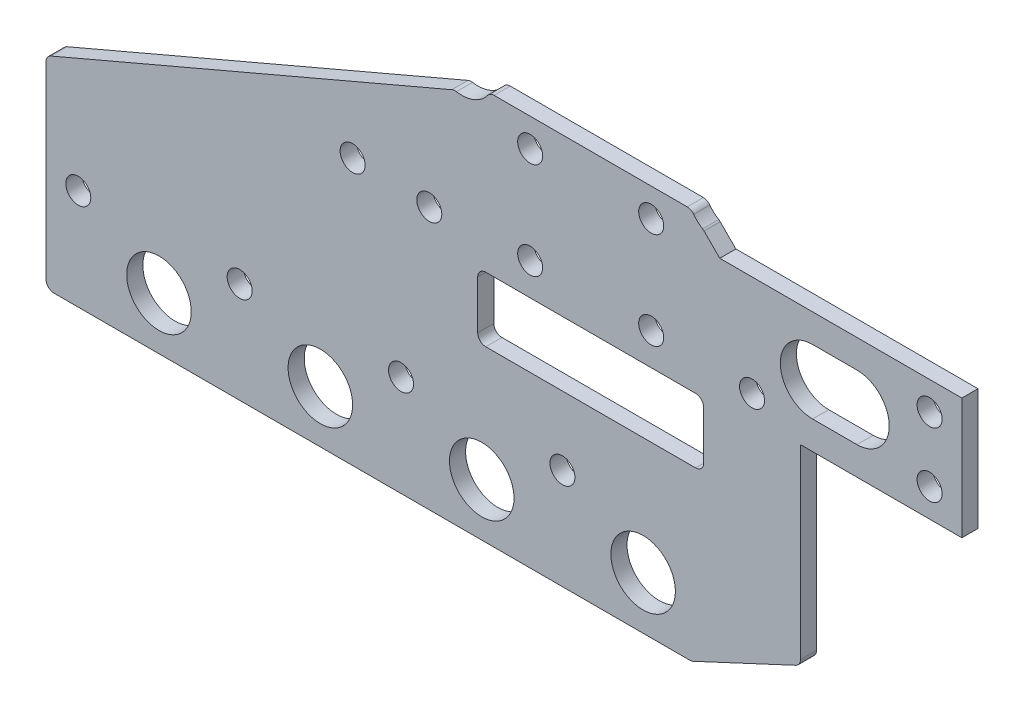
from build123d import *

# Parameters (mm, degrees)
SKETCH_1_R          = 4
SKETCH_1_R_2        = 1.55
SKETCH_1_W          = 28
SKETCH_1_H          = 8
EXTRUDE_1_DEPTH     = 2
SKETCH_2_R          = 4
CUT_EXTRUDE_1_DEPTH = 10
FILLET_2_R          = 1


with BuildPart() as part:
    # 草图1 → 凸台-拉伸1 (new body)
    with BuildSketch(Plane.XY):
        Polygon((-80, 0), (0, 0), (13.5, 6.295153385), (13.5, 30), (33.5, 30), (33.5, 45), (3.5, 45), (0, 48.5), (-25, 48.5), (-34.361702128, 44.5), (-35.671585242, 43.940322669), (-80, 25), align=None)
        with Locations((-66, 6.5)):
            Circle(SKETCH_1_R, mode=Mode.SUBTRACT)
        with Locations((-46, 6.5)):
            Circle(SKETCH_1_R, mode=Mode.SUBTRACT)
        with Locations((-76, 12.5)):
            Circle(SKETCH_1_R_2, mode=Mode.SUBTRACT)
        with Locations((-56, 12.5)):
            Circle(SKETCH_1_R_2, mode=Mode.SUBTRACT)
        with Locations((-36, 12.5)):
            Circle(SKETCH_1_R_2, mode=Mode.SUBTRACT)
        with Locations((-26, 6.5)):
            Circle(SKETCH_1_R, mode=Mode.SUBTRACT)
        with Locations((-6, 6.5)):
            Circle(SKETCH_1_R, mode=Mode.SUBTRACT)
        with Locations((-16, 12.5)):
            Circle(SKETCH_1_R_2, mode=Mode.SUBTRACT)
        with Locations((-42, 33)):
            Circle(SKETCH_1_R_2, mode=Mode.SUBTRACT)
        with Locations((-32.5, 32.5)):
            Circle(SKETCH_1_R_2, mode=Mode.SUBTRACT)
        with Locations((-12.5, 25)):
            Rectangle(SKETCH_1_W, SKETCH_1_H, mode=Mode.SUBTRACT)
        with Locations((-20, 33)):
            Circle(SKETCH_1_R_2, mode=Mode.SUBTRACT)
        with Locations((-5, 33)):
            Circle(SKETCH_1_R_2, mode=Mode.SUBTRACT)
        with Locations((7.5, 32.5)):
            Circle(SKETCH_1_R_2, mode=Mode.SUBTRACT)
        with Locations((29.5, 33.5)):
            Circle(SKETCH_1_R_2, mode=Mode.SUBTRACT)
        with Locations((-20, 45)):
            Circle(SKETCH_1_R_2, mode=Mode.SUBTRACT)
        with Locations((-5, 45)):
            Circle(SKETCH_1_R_2, mode=Mode.SUBTRACT)
        with BuildLine():
            ThreePointArc((13.5, 33.791900756), (11.07365329, 38.26406905), (15, 41.5))
            Line((15, 41.5), (20.5, 41.5))
            ThreePointArc((20.5, 41.5), (24.5, 37.5), (20.5, 33.5))
            Line((20.5, 33.5), (15, 33.5))
            ThreePointArc((15, 33.5), (14.23593095, 33.57365329), (13.5, 33.791900756))
        make_face(mode=Mode.SUBTRACT)
        with Locations((29.5, 41.5)):
            Circle(SKETCH_1_R_2, mode=Mode.SUBTRACT)
    extrude(amount=EXTRUDE_1_DEPTH)

    # 草图2 → 切除-拉伸1 (cut)
    with BuildSketch(Plane.XY.offset(2)):
        with Locations((3.464101615, 50.5)):
            Circle(SKETCH_2_R)
        with Locations((-28.464101615, 50.5)):
            Circle(SKETCH_2_R)
    extrude(amount=-CUT_EXTRUDE_1_DEPTH, mode=Mode.SUBTRACT)

    # 圆角2
    fillet_2_edges = [part.edges().sort_by_distance(p)[0] for p in [
        (1.464101615, 47.035898385, 1),
        (-29.413394303, 46.614276979, 1),
        (1.5, 21, 1),
        (1.5, 29, 1),
        (-26.5, 29, 1),
        (-26.5, 21, 1),
        (13.5, 6.295153385, 1),
        (0, 0, 1),
        (-80, 0, 1),
        (-80, 25, 1),
        (-25, 48.5, 1),
        (0, 48.5, 1),
    ]]
    fillet(fillet_2_edges, radius=FILLET_2_R)


solid = part.part
